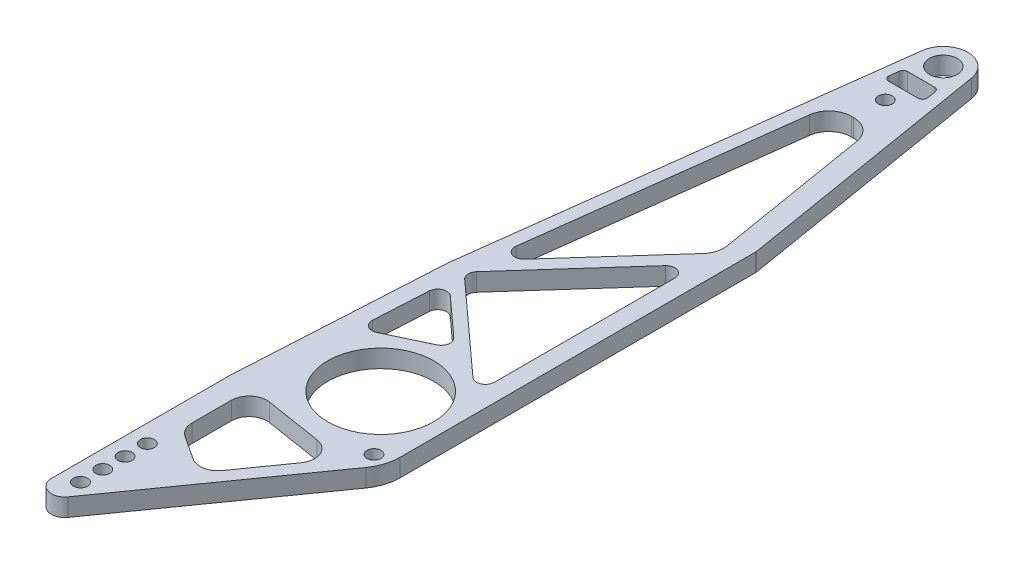
from build123d import *

# Parameters (mm, degrees)
SKETCH11_R          = 3.96875
SKETCH11_R_2        = 15.08125
SKETCH11_R_3        = 2
BOSS_EXTRUDE2_DEPTH = 5.08


with BuildPart() as part:
    # Sketch11 → Boss-Extrude2 (new body)
    with BuildSketch(Plane(origin=(0, 0, 0), x_dir=(1, 0, 0), z_dir=(0, 1, 0))):
        with BuildLine():
            Line((19.05, -173.758834345), (19.05, -72.598586407))
            ThreePointArc((19.05, -72.598586407), (19.041478453, -72.390699795), (19.015970989, -72.184208077))
            Line((19.015970989, -72.184208077), (6.891420221, 1.139540409))
            ThreePointArc((6.891420221, 1.139540409), (-0.132898533, 6.983735604), (-6.929785414, 0.876526736))
            Line((-6.929785414, 0.876526736), (-22.088986057, -118.971508934))
            Line((-22.088986057, -118.971508934), (-25.39598653, -177.728690609))
            ThreePointArc((-25.39598653, -177.728690609), (-25.398996434, -177.800028219), (-25.4, -177.871422245))
            Line((-25.4, -177.871422245), (-25.4, -228.6))
            ThreePointArc((-25.4, -228.6), (-22.745272537, -232.230626029), (-18.480606107, -230.801765114))
            Line((-18.480606107, -230.801765114), (16.71464631, -181.098051393))
            ThreePointArc((16.71464631, -181.098051393), (18.452086765, -177.609742801), (19.05, -173.758834345))
        make_face()
        with Locations(Location((0, 0, 0), (0, 0, 270))):
            Circle(SKETCH11_R, mode=Mode.SUBTRACT)
        with Locations(Location((0, -160.246508934, 0), (0, 0, 270))):
            Circle(SKETCH11_R_2, mode=Mode.SUBTRACT)
        with Locations(Location((-20.32, -225.425, 0), (0, 0, 270))):
            Circle(SKETCH11_R_3, mode=Mode.SUBTRACT)
        with Locations(Location((-20.32, -219.075, 0), (0, 0, 270))):
            Circle(SKETCH11_R_3, mode=Mode.SUBTRACT)
        with Locations(Location((-20.32, -212.725, 0), (0, 0, 270))):
            Circle(SKETCH11_R_3, mode=Mode.SUBTRACT)
        with Locations(Location((-20.32, -206.375, 0), (0, 0, 270))):
            Circle(SKETCH11_R_3, mode=Mode.SUBTRACT)
        with Locations(Location((0, -16.51, 0), (0, 0, 270))):
            Circle(SKETCH11_R_3, mode=Mode.SUBTRACT)
        with Locations(Location((14.605, -176.756508934, 0), (0, 0, 270))):
            Circle(SKETCH11_R_3, mode=Mode.SUBTRACT)
        with BuildLine():
            Line((11.940278596, -80.334093652), (-12.090624848, -107.18518059))
            ThreePointArc((-12.090624848, -107.18518059), (-15.037374992, -107.802243553), (-16.503240932, -105.172540118))
            Line((-16.503240932, -105.172540118), (-7.115464935, -30.953157513))
            ThreePointArc((-7.115464935, -30.953157513), (-5.014621207, -26.986469282), (-0.815660013, -25.4))
            Line((-0.815660013, -25.4), (-0.124902871, -25.4))
            ThreePointArc((-0.124902871, -25.4), (3.982665997, -26.907440966), (6.140024603, -30.714054174))
            Line((6.140024603, -30.714054174), (13.473470783, -75.063389134))
            ThreePointArc((13.473470783, -75.063389134), (13.305815609, -77.87296697), (11.940278596, -80.334093652))
        make_face(mode=Mode.SUBTRACT)
        with BuildLine():
            Line((13.97, -141.812492878), (13.97, -90.426050798))
            ThreePointArc((13.97, -90.426050798), (12.336685433, -88.053389523), (9.537305885, -88.732147321))
            Line((9.537305885, -88.732147321), (-15.843545445, -117.091607347))
            ThreePointArc((-15.843545445, -117.091607347), (-16.487420873, -118.917476564), (-15.657551613, -120.666673802))
            Line((-15.657551613, -120.666673802), (9.723299718, -143.693655856))
            ThreePointArc((9.723299718, -143.693655856), (12.458732541, -144.134842843), (13.97, -141.812492878))
        make_face(mode=Mode.SUBTRACT)
        with BuildLine():
            Line((-13.582521272, -126.836237527), (-2.809524218, -136.610125984))
            ThreePointArc((-2.809524218, -136.610125984), (-2.003545388, -138.86283126), (-3.426980373, -140.785879825))
            Line((-3.426980373, -140.785879825), (-15.060903725, -146.30851259))
            ThreePointArc((-15.060903725, -146.30851259), (-17.567328552, -146.121811397), (-18.686134382, -143.87119009))
            Line((-18.686134382, -143.87119009), (-17.825208084, -128.574668869))
            ThreePointArc((-17.825208084, -128.574668869), (-16.252271294, -126.367052616), (-13.582521272, -126.836237527))
        make_face(mode=Mode.SUBTRACT)
        with BuildLine():
            Line((6.282161105, -189.238159376), (-3.018903236, -202.373380963))
            ThreePointArc((-3.018903236, -202.373380963), (-6.220540057, -204.429171418), (-9.951861921, -203.684866462))
            Line((-9.951861921, -203.684866462), (-16.757100161, -199.219099788))
            ThreePointArc((-16.757100161, -199.219099788), (-18.440171631, -197.385216843), (-19.05, -194.971927471))
            Line((-19.05, -194.971927471), (-19.05, -183.748869713))
            ThreePointArc((-19.05, -183.748869713), (-17.268890157, -179.885746141), (-13.174518217, -178.731538875))
            Line((-13.174518217, -178.731538875), (2.931784364, -181.28514172))
            ThreePointArc((2.931784364, -181.28514172), (6.817844364, -184.330274157), (6.282161105, -189.238159376))
        make_face(mode=Mode.SUBTRACT)
        with BuildLine():
            Line((3.834506832, -6.35), (-3.834506832, -6.35))
            ThreePointArc((-3.834506832, -6.35), (-4.67429907, -6.667293856), (-5.094467816, -7.460631503))
            Line((-5.094467816, -7.460631503), (-5.415744418, -10.000631503))
            ThreePointArc((-5.415744418, -10.000631503), (-5.108489577, -10.999792239), (-4.155783434, -11.43))
            Line((-4.155783434, -11.43), (4.254512077, -11.43))
            ThreePointArc((4.254512077, -11.43), (5.223023884, -10.981513774), (5.507497571, -9.952810835))
            Line((5.507497571, -9.952810835), (5.087492326, -7.412810835))
            ThreePointArc((5.087492326, -7.412810835), (4.656020605, -6.651488193), (3.834506832, -6.35))
        make_face(mode=Mode.SUBTRACT)
    extrude(amount=-BOSS_EXTRUDE2_DEPTH)


solid = part.part
